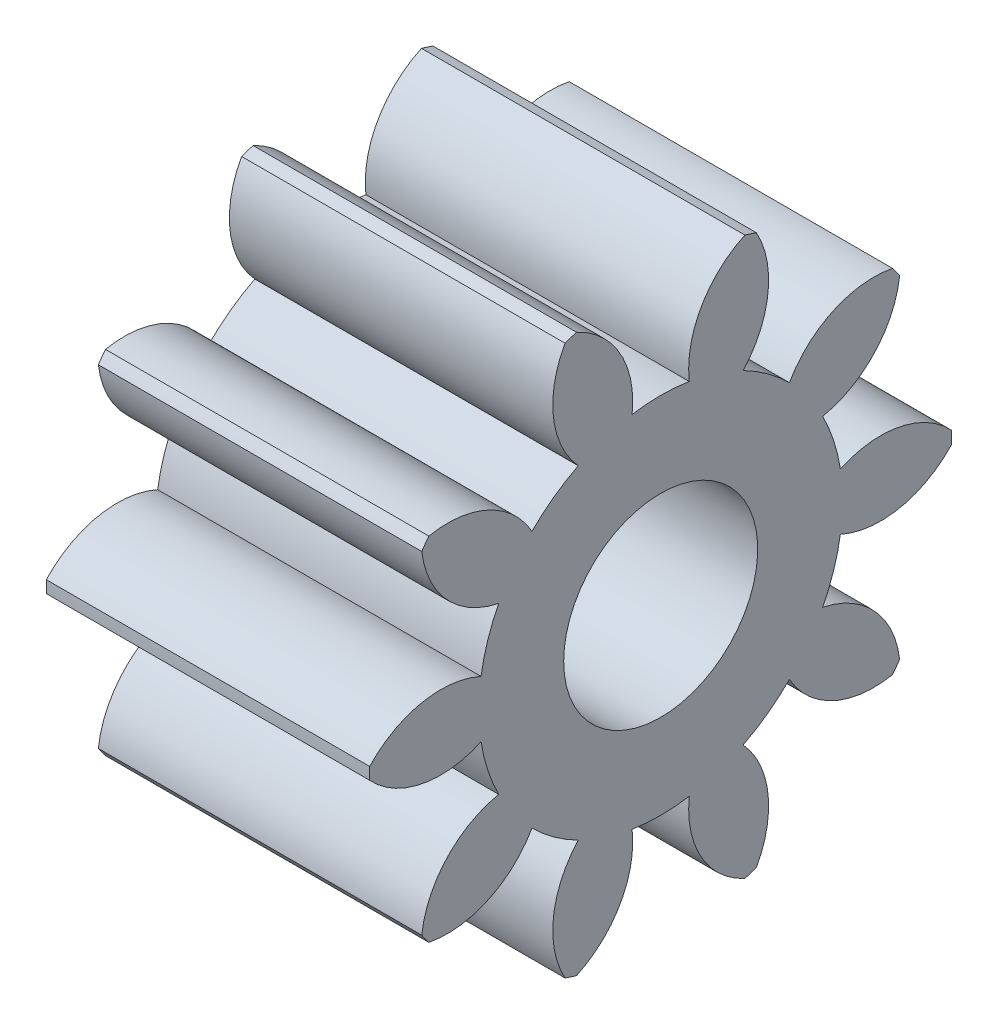
from build123d import *

# Parameters (mm, degrees)
BASPROSKE_W     = 10
BASPROSKE_H     = 9
TOOTHCUT_DEPTH  = 17.186414056
TEETHCUTS_COUNT = 10
TEETHCUTS_ANGLE = 324
BORSKE_R        = 3
BORE_DEPTH      = 50.0000508


with BuildPart() as part:
    # BasProSke → Base-Revolve (revolve)
    with BuildSketch(Plane(origin=(0, 0, 0), x_dir=(1, 0, 0), z_dir=(0, 1, 0)), mode=Mode.PRIVATE) as base_revolve_sk:
        with Locations((5, 4.5)):
            Rectangle(BASPROSKE_W, BASPROSKE_H)
    revolve(base_revolve_sk.sketch.rotate(Axis((-10, 0, 0), (1, 0, 0)), 180), axis=Axis((-10, 0, 0), (1, 0, 0)))

    # TooCutSke → ToothCut (cut, through all)
    with BuildSketch(Plane(origin=(0, 0, 0), x_dir=(0, 0, -1), z_dir=(1, 0, 0))):
        with BuildLine():
            ThreePointArc((0.883878355, 5.554109745), (0, 5.624), (-0.883878355, 5.554109745))
            ThreePointArc((-0.883878355, 5.554109745), (-1.258245767, 7.379188248), (-2.637816971, 8.631324741))
            ThreePointArc((-2.637816971, 8.631324741), (0, 9.0254), (2.637816971, 8.631324741))
            ThreePointArc((2.637816971, 8.631324741), (1.258245767, 7.379188248), (0.883878355, 5.554109745))
        make_face()
    toothcut = extrude(amount=TOOTHCUT_DEPTH, mode=Mode.SUBTRACT)

    # TeethCuts: ToothCut ×10 about axis
    teethcuts_axis = Axis((-10, 0, 0), (1, 0, 0))
    for i in range(1, TEETHCUTS_COUNT):
        add(toothcut.rotate(teethcuts_axis, i * TEETHCUTS_ANGLE / (TEETHCUTS_COUNT - 1)), mode=Mode.SUBTRACT)

    # BorSke → Bore (cut, symmetric)
    with BuildSketch(Plane(origin=(0, 0, 0), x_dir=(0, 0, -1), z_dir=(1, 0, 0))):
        with Locations(Location((0, 0, 0), (0, 0, 180))):
            Circle(BORSKE_R)
    extrude(amount=BORE_DEPTH, both=True, mode=Mode.SUBTRACT)


solid = part.part
